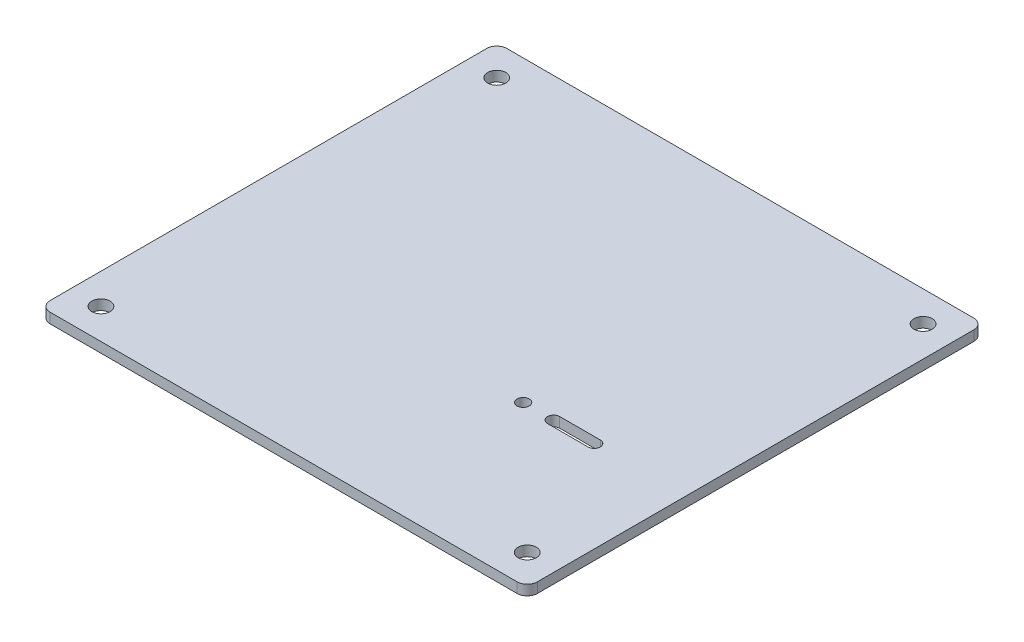
from build123d import *

# Parameters (mm, degrees)
SKETCH1_W                = 350
SKETCH1_H                = 200
BOSS_EXTRUDE1_DEPTH      = 5
M4_CLEARANCE_HOLE2_D     = 4.5
M4_CLEARANCE_HOLE2_DEPTH = 10
M4_CLEARANCE_HOLE2_TIP   = 1.351936393
SKETCH8_R                = 3
CUT_EXTRUDE2_DEPTH       = 404.143894906
SKETCH10_W               = 110
SKETCH10_H               = 200
CUT_EXTRUDE4_DEPTH       = 404.143894906
SKETCH11_W               = 240
SKETCH11_H               = 25
BOSS_EXTRUDE2_DEPTH      = 5
M8_CLEARANCE_HOLE1_D     = 9
FILLET3_R                = 5


with BuildPart() as part:
    # Sketch1 → Boss-Extrude1 (new body)
    with BuildSketch(Plane(origin=(0, 0, 0), x_dir=(1, 0, 0), z_dir=(0, 1, 0))):
        with Locations((175, 100)):
            Rectangle(SKETCH1_W, SKETCH1_H)
    extrude(amount=BOSS_EXTRUDE1_DEPTH)

    # M4 Clearance Hole2
    with Locations(Plane(origin=(0, 5, 0), x_dir=(1, 0, 0), z_dir=(0, 1, 0))):
        with Locations((279.726995352, 76.5), (279.726995352, 123.5), (303.226995352, 100), (256.226995352, 100)):
            Hole(M4_CLEARANCE_HOLE2_D / 2, depth=M4_CLEARANCE_HOLE2_DEPTH)
            with Locations((0, 0, -(M4_CLEARANCE_HOLE2_DEPTH + M4_CLEARANCE_HOLE2_TIP / 2))):  # 118° drill point
                Cone(0, M4_CLEARANCE_HOLE2_D / 2, M4_CLEARANCE_HOLE2_TIP, mode=Mode.SUBTRACT)

    # Sketch8 → Cut-Extrude2 (cut, through all)
    with BuildSketch(Plane(origin=(0, 5, 0), x_dir=(1, 0, 0), z_dir=(0, 1, 0))):
        with Locations(Location((159.999156247, 78, 0), (0, 0, 270))):
            Circle(SKETCH8_R)
        with BuildLine():
            Line((174.999156247, 81), (194.999156247, 81))
            ThreePointArc((194.999156247, 81), (197.999156247, 78), (194.999156247, 75))
            Line((194.999156247, 75), (174.999156247, 75))
            ThreePointArc((174.999156247, 75), (171.999156247, 78), (174.999156247, 81))
        make_face()
    extrude(amount=-CUT_EXTRUDE2_DEPTH, mode=Mode.SUBTRACT)

    # Sketch10 → Cut-Extrude4 (cut, through all)
    with BuildSketch(Plane(origin=(0, 5, 0), x_dir=(1, 0, 0), z_dir=(0, 1, 0))):
        with Locations((295, 100)):
            Rectangle(SKETCH10_W, SKETCH10_H)
    extrude(amount=-CUT_EXTRUDE4_DEPTH, mode=Mode.SUBTRACT)

    # Sketch11 → Boss-Extrude2 (add)
    with BuildSketch(Plane(origin=(0, 5, 0), x_dir=(1, 0, 0), z_dir=(0, 1, 0))):
        with Locations((120, 212.5)):
            Rectangle(SKETCH11_W, SKETCH11_H)
    extrude(amount=-BOSS_EXTRUDE2_DEPTH)

    # M8 Clearance Hole1 (through all)
    with Locations(Plane(origin=(0, 5, 0), x_dir=(1, 0, 0), z_dir=(0, 1, 0))):
        with Locations((15, 15), (225, 15), (225, 210), (15, 210)):
            Hole(M8_CLEARANCE_HOLE1_D / 2)

    # Fillet3
    fillet3_edges = [part.edges().sort_by_distance(p)[0] for p in [
        (240, 2.5, 0),
        (0, 2.5, 0),
        (0, 2.5, -225),
        (240, 2.5, -225),
    ]]
    fillet(fillet3_edges, radius=FILLET3_R)


solid = part.part
